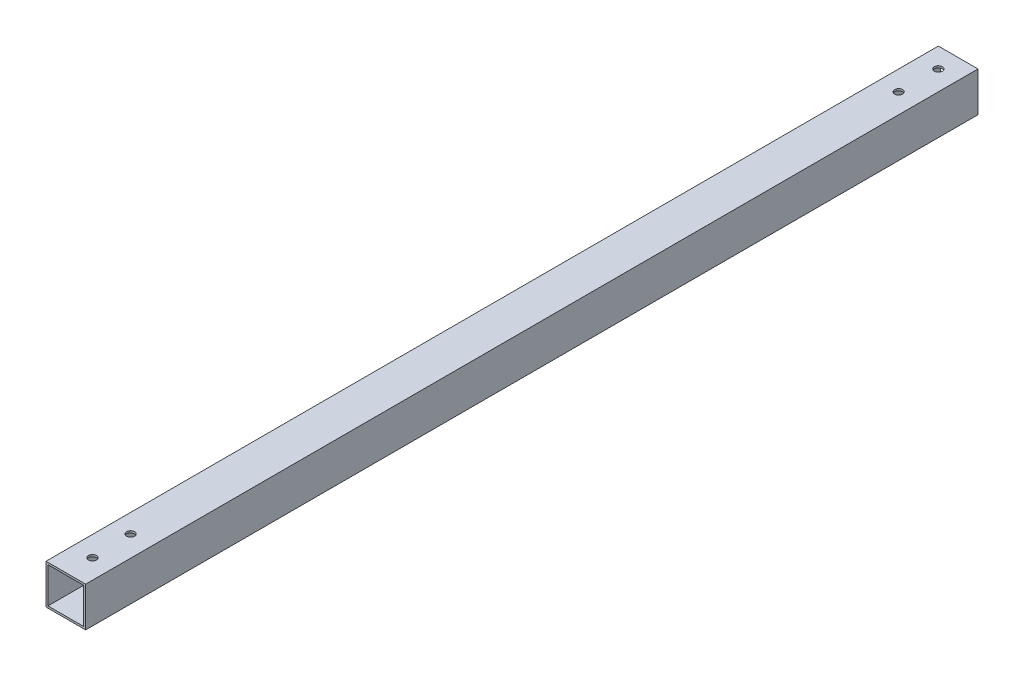
from build123d import *

# Parameters (mm, degrees)
SKETCH_1_W          = 20
SKETCH_1_H          = 20
SKETCH_1_W_2        = 18
SKETCH_1_H_2        = 18
EXTRUDE_1_DEPTH     = 450
SKETCH_2_R          = 2
CUT_EXTRUDE_1_DEPTH = 430
SKETCH_3_R          = 2
CUT_EXTRUDE_2_DEPTH = 430


with BuildPart() as part:
    # 草图1 → 凸台-拉伸1 (new body)
    with BuildSketch(Plane.XY):
        Rectangle(SKETCH_1_W, SKETCH_1_H)
        Rectangle(SKETCH_1_W_2, SKETCH_1_H_2, mode=Mode.SUBTRACT)
    extrude(amount=EXTRUDE_1_DEPTH)

    # 草图2 → 切除-拉伸1 (cut)
    with BuildSketch(Plane(origin=(0, 10, 0), x_dir=(1, 0, 0), z_dir=(0, 1, 0))):
        with Locations(Location((0, -10, 0), (0, 0, 180))):
            Circle(SKETCH_2_R)
        with Locations(Location((0, -30, 0), (0, 0, 180))):
            Circle(SKETCH_2_R)
    extrude(amount=-CUT_EXTRUDE_1_DEPTH, mode=Mode.SUBTRACT)

    # 草图3 → 切除-拉伸2 (cut)
    with BuildSketch(Plane(origin=(0, 10, 0), x_dir=(1, 0, 0), z_dir=(0, 1, 0))):
        with Locations(Location((0.20088202, -436.720938128, 0), (0, 0, 180))):
            Circle(SKETCH_3_R)
        with Locations(Location((-0.572874553, -416.735911214, 0), (0, 0, 180))):
            Circle(SKETCH_3_R)
    extrude(amount=-CUT_EXTRUDE_2_DEPTH, mode=Mode.SUBTRACT)


solid = part.part
